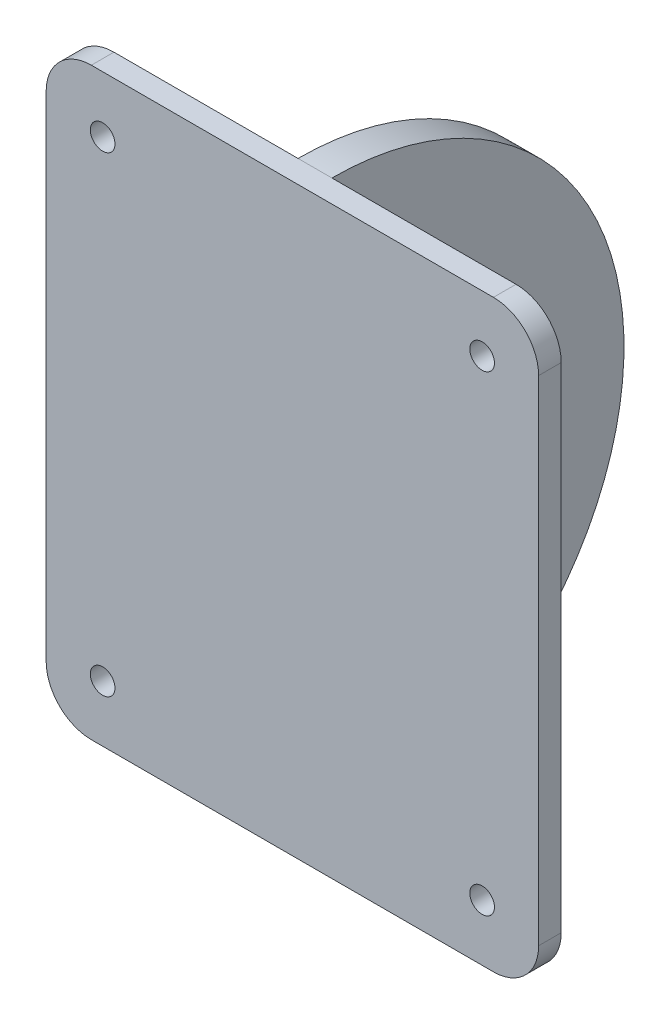
from build123d import *

# Parameters (mm, degrees)
SKETCH1_W           = 43.598
SKETCH1_H           = 51.7166
BOSS_EXTRUDE1_DEPTH = 2
FILLET1_R           = 4
SKETCH2_R           = 1.0922
CUT_EXTRUDE1_DEPTH  = 2
BOSS_EXTRUDE2_DEPTH = 1.5
CUT_EXTRUDE2_REACH  = 45.361
SKETCH6_R           = 5


with BuildPart() as part:
    # Sketch1 → Boss-Extrude1 (new body)
    with BuildSketch(Plane.XY):
        Rectangle(SKETCH1_W, SKETCH1_H)
    extrude(amount=BOSS_EXTRUDE1_DEPTH)

    # Fillet1
    fillet1_edges = [part.edges().sort_by_distance(p)[0] for p in [
        (21.799, -25.8583, 1),
        (-21.799, -25.8583, 1),
        (-21.799, 25.8583, 1),
        (21.799, 25.8583, 1),
    ]]
    fillet(fillet1_edges, radius=FILLET1_R)

    # Sketch2 → Cut-Extrude1 (cut)
    with BuildSketch(Plane.XY.offset(2)):
        with Locations((-16.799, 20.8583)):
            Circle(SKETCH2_R)
        with Locations((16.799, 20.8583)):
            Circle(SKETCH2_R)
        with Locations((-16.799, -20.8583)):
            Circle(SKETCH2_R)
        with Locations((16.799, -20.8583)):
            Circle(SKETCH2_R)
    extrude(amount=-CUT_EXTRUDE1_DEPTH, mode=Mode.SUBTRACT)

    # Sketch5 → Boss-Extrude2 (add, symmetric)
    with BuildSketch(Plane(origin=(0, 0, 0), x_dir=(0, 0, -1), z_dir=(1, 0, 0))):
        with BuildLine():
            Line((0, 25.8583), (0, -25.8583))
            ThreePointArc((0, -25.8583), (25.8583, 0), (0, 25.8583))
        make_face()
    extrude(amount=BOSS_EXTRUDE2_DEPTH, both=True)

    # Sketch6 → Cut-Extrude2 (cut, up to next)
    with BuildSketch(Plane(origin=(1.5, 0, 0), x_dir=(0, 0, -1), z_dir=(1, 0, 0)), mode=Mode.PRIVATE) as cut_extrude2_sk1:
        with Locations((10.61, 0)):
            Circle(SKETCH6_R)
    cut_extrude2_tool1 = extrude(cut_extrude2_sk1.sketch, amount=-CUT_EXTRUDE2_REACH, mode=Mode.PRIVATE) & part.part
    add(cut_extrude2_tool1.solids().sort_by_distance((1.5, 0, -10.61))[0], mode=Mode.SUBTRACT)


solid = part.part
